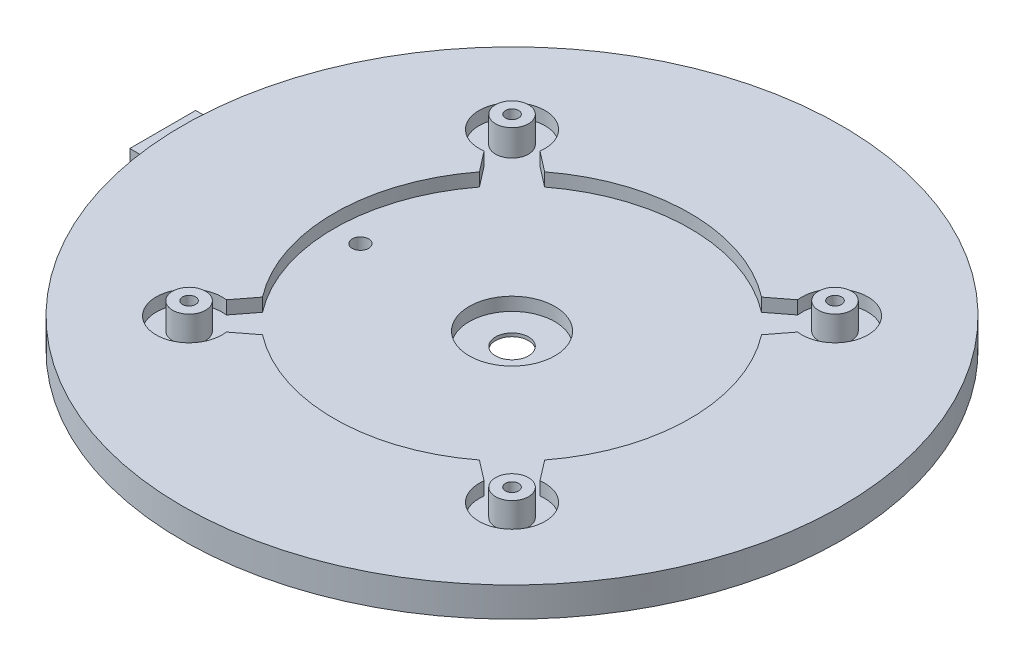
from build123d import *

# Parameters (mm, degrees)
SKETCH1_R                               = 50
BOSS_EXTRUDE1_DEPTH                     = 4.5
BOSS_EXTRUDE2_DEPTH                     = 5
SKETCH4_R                               = 18
SKETCH4_R_2                             = 16
EXTRUDE_THIN1_DEPTH                     = 5
SKETCH7_R                               = 27
CUT_EXTRUDE1_DEPTH                      = 2
CBORE_FOR_M5_HEX_HEAD_BOLT2_D           = 5
CBORE_FOR_M5_HEX_HEAD_BOLT2_CBORE_D     = 13
CBORE_FOR_M5_HEX_HEAD_BOLT2_CBORE_DEPTH = 2
CUT_EXTRUDE2_DEPTH                      = 74.247866863
SKETCH11_R                              = 2.5
BOSS_EXTRUDE3_DEPTH                     = 4
SKETCH12_R                              = 1
CUT_EXTRUDE3_DEPTH                      = 74.764829018
EXTRUDE_THIN2_REACH                     = 75.765
SKETCH13_R                              = 2.5
SKETCH13_R_2                            = 1.5
CIRPATTERN1_COUNT                       = 4
SKETCH14_R                              = 1.25
CUT_EXTRUDE4_DEPTH                      = 74.247866863


with BuildPart() as part:
    # Sketch1 → Boss-Extrude1 (new body)
    with BuildSketch(Plane(origin=(0, 0, 0), x_dir=(1, 0, 0), z_dir=(0, 1, 0))):
        with Locations(Location((0, 0, 0), (0, 0, 270))):
            Circle(SKETCH1_R)
    extrude(amount=BOSS_EXTRUDE1_DEPTH)

    # Sketch3 → Boss-Extrude2 (add, symmetric)
    with BuildSketch(Plane.XY):
        with BuildLine():
            Line((0, 2.5), (-53, 2.5))
            Line((-53, 2.5), (-53, -2.25))
            ThreePointArc((-53, -2.25), (-51.75, -3.5), (-50.5, -2.25))
            Line((-50.5, -2.25), (-50.5, 0))
            Line((-50.5, 0), (0, 0))
            Line((0, 0), (0, 2.5))
        make_face()
    extrude(amount=BOSS_EXTRUDE2_DEPTH, both=True)

    # Sketch4 → Extrude-Thin1 (add)
    with BuildSketch(Plane.XZ):
        Circle(SKETCH4_R)
        Circle(SKETCH4_R_2, mode=Mode.SUBTRACT)
    extrude(amount=EXTRUDE_THIN1_DEPTH)

    # Sketch7 → Cut-Extrude1 (cut)
    with BuildSketch(Plane(origin=(0, 4.5, 0), x_dir=(1, 0, 0), z_dir=(0, 1, 0))):
        with Locations(Location((0, 0, 0), (0, 0, 270))):
            Circle(SKETCH7_R)
    extrude(amount=-CUT_EXTRUDE1_DEPTH, mode=Mode.SUBTRACT)

    # CBORE for M5 Hex Head Bolt2 (through all)
    with Locations(Plane(origin=(0, 2.5, 0), x_dir=(1, 0, 0), z_dir=(0, 1, 0))):
        with Locations((0, 0)):
            CounterBoreHole(CBORE_FOR_M5_HEX_HEAD_BOLT2_D / 2, CBORE_FOR_M5_HEX_HEAD_BOLT2_CBORE_D / 2, CBORE_FOR_M5_HEX_HEAD_BOLT2_CBORE_DEPTH)

    # Sketch10 → Cut-Extrude2 (cut, through all)
    with BuildSketch(Plane(origin=(0, 2.5, 0), x_dir=(1, 0, 0), z_dir=(0, 1, 0))):
        with BuildLine():
            Line((-21.405668752, 16.455921283), (-23.792893219, 19.550252532))
            ThreePointArc((-23.792893219, 19.550252532), (-28.035533906, 28.035533906), (-19.550252532, 23.792893219))
            Line((-19.550252532, 23.792893219), (-16.455921283, 21.405668752))
            ThreePointArc((-16.455921283, 21.405668752), (-19.091883092, 19.091883092), (-21.405668752, 16.455921283))
        make_face()
    cut_extrude2 = extrude(amount=CUT_EXTRUDE2_DEPTH, mode=Mode.SUBTRACT)

    # Sketch11 → Boss-Extrude3 (add)
    with BuildSketch(Plane(origin=(0, 2.5, 0), x_dir=(1, 0, 0), z_dir=(0, 1, 0))):
        with Locations(Location((-24.5, 24.5, 0), (0, 0, 270))):
            Circle(SKETCH11_R)
    boss_extrude3 = extrude(amount=BOSS_EXTRUDE3_DEPTH)

    # Sketch12 → Cut-Extrude3 (cut, through all)
    with BuildSketch(Plane(origin=(0, 6.5, 0), x_dir=(1, 0, 0), z_dir=(0, 1, 0))):
        with Locations(Location((-24.5, 24.5, 0), (0, 0, 270))):
            Circle(SKETCH12_R)
    cut_extrude3 = extrude(amount=-CUT_EXTRUDE3_DEPTH, mode=Mode.SUBTRACT)

    # Sketch13 → Extrude-Thin2 (add, up to next)
    with BuildSketch(Plane.XZ.offset(5), mode=Mode.PRIVATE) as extrude_thin2_sk1:
        with Locations((-14, 0)):
            Circle(SKETCH13_R)
        with Locations((-14, 0)):
            Circle(SKETCH13_R_2, mode=Mode.SUBTRACT)
    extrude_thin2_tool1 = extrude(extrude_thin2_sk1.sketch, amount=-EXTRUDE_THIN2_REACH, mode=Mode.PRIVATE) - part.part
    extrude_thin2 = extrude_thin2_tool1.solids().sort_by_distance((-16.429289, -5, 0))[0]
    add(extrude_thin2)

    # CirPattern1: Cut-Extrude2, Boss-Extrude3, Cut-Extrude3, Extrude-Thin2 ×4 about axis
    cirpattern1_axis = Axis((0, 0, 0), (0, 1, 0))
    add([cut_extrude2.rotate(cirpattern1_axis, i * 360 / CIRPATTERN1_COUNT) for i in range(1, CIRPATTERN1_COUNT)], mode=Mode.SUBTRACT)
    add([boss_extrude3.rotate(cirpattern1_axis, i * 360 / CIRPATTERN1_COUNT) for i in range(1, CIRPATTERN1_COUNT)])
    add([cut_extrude3.rotate(cirpattern1_axis, i * 360 / CIRPATTERN1_COUNT) for i in range(1, CIRPATTERN1_COUNT)], mode=Mode.SUBTRACT)
    add([extrude_thin2.rotate(cirpattern1_axis, i * 360 / CIRPATTERN1_COUNT) for i in range(1, CIRPATTERN1_COUNT)])

    # Sketch14 → Cut-Extrude4 (cut, through all)
    with BuildSketch(Plane(origin=(0, 2.5, 0), x_dir=(1, 0, 0), z_dir=(0, 1, 0))):
        with Locations(Location((-23, 0, 0), (0, 0, 270))):
            Circle(SKETCH14_R)
    extrude(amount=-CUT_EXTRUDE4_DEPTH, mode=Mode.SUBTRACT)


solid = part.part
